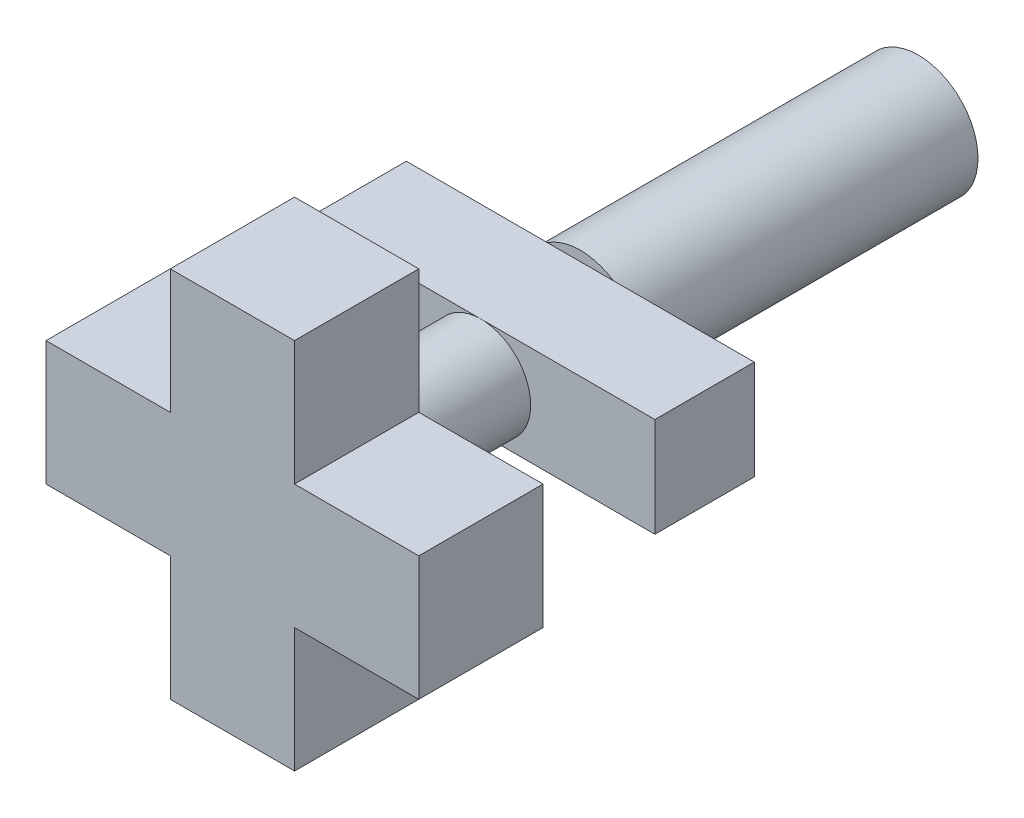
from build123d import *

# Parameters (mm, degrees)
SKETCH2_R           = 3.048
BOSS_EXTRUDE1_DEPTH = 17.272
SKETCH3_W           = 17.78
SKETCH3_H           = 5.08
BOSS_EXTRUDE2_DEPTH = 5.08
SKETCH4_R           = 2.54
BOSS_EXTRUDE3_DEPTH = 6.35
BOSS_EXTRUDE4_DEPTH = 6.35


with BuildPart() as part:
    # Sketch2 → Boss-Extrude1 (new body)
    with BuildSketch(Plane.XY):
        Circle(SKETCH2_R)
    extrude(amount=BOSS_EXTRUDE1_DEPTH)

    # Sketch3 → Boss-Extrude2 (add)
    with BuildSketch(Plane.XY.offset(17.272)):
        Rectangle(SKETCH3_W, SKETCH3_H)
    extrude(amount=BOSS_EXTRUDE2_DEPTH)

    # Sketch4 → Boss-Extrude3 (add)
    with BuildSketch(Plane.XY.offset(22.352)):
        with Locations(Location((0, 0, 0), (0, 0, 270))):
            Circle(SKETCH4_R)
    extrude(amount=BOSS_EXTRUDE3_DEPTH)

    # Sketch5 → Boss-Extrude4 (add)
    with BuildSketch(Plane.XY.offset(28.702)):
        Polygon((-3.175, 3.175), (-3.175, 9.525), (3.175, 9.525), (3.175, 3.175), (9.525, 3.175), (9.525, -3.175), (3.175, -3.175), (3.175, -9.525), (-3.175, -9.525), (-3.175, -3.175), (-9.525, -3.175), (-9.525, 3.175), align=None)
    extrude(amount=BOSS_EXTRUDE4_DEPTH)


solid = part.part
